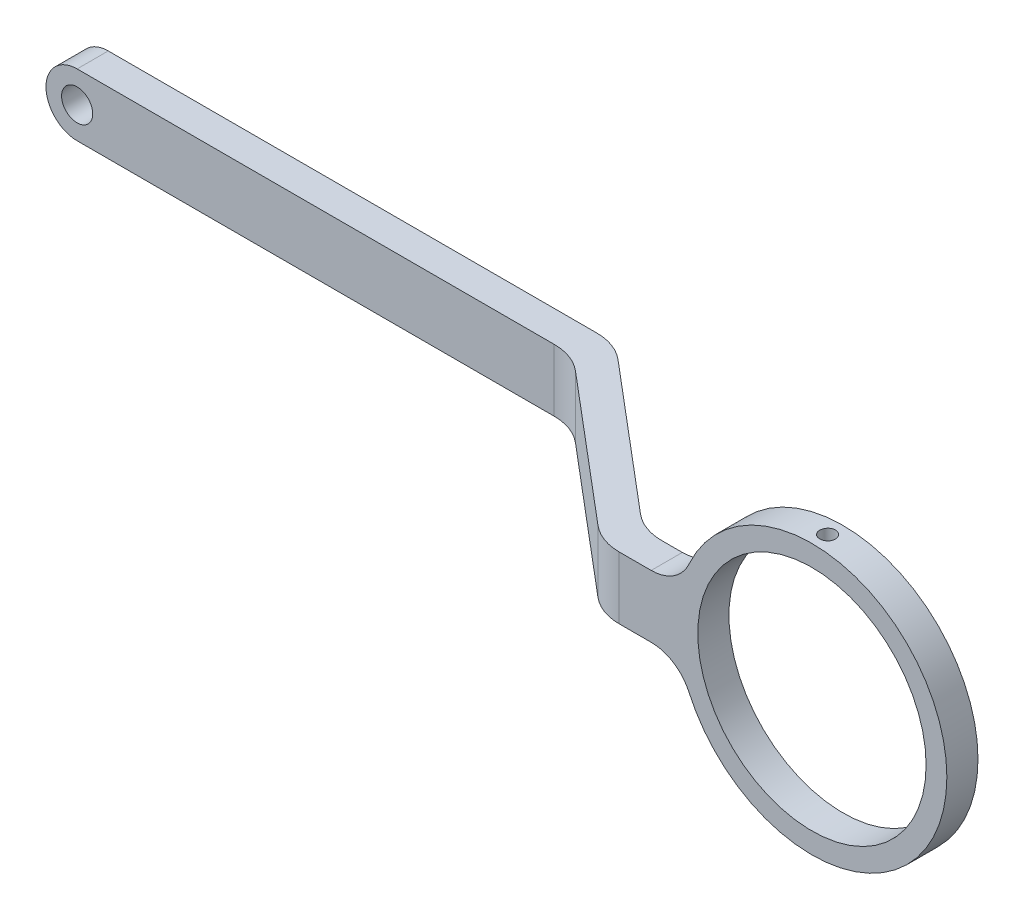
from build123d import *

# Parameters (mm, degrees)
BOSS_EXTRUDE1_DEPTH = 76.2
FILLET1_R           = 127
CUT_EXTRUDE1_DEPTH  = 152.4
SKETCH4_R           = 38.1
CUT_EXTRUDE2_DEPTH  = 152.4
SKETCH5_R           = 330.2
SKETCH5_R_2         = 279.4
BOSS_EXTRUDE2_DEPTH = 76.2
CUT_EXTRUDE3_DEPTH  = 76.2
SKETCH7_R           = 279.4
CUT_EXTRUDE4_DEPTH  = 76.2
FILLET2_R           = 101.6
SKETCH10_R          = 19.05
CUT_EXTRUDE5_DEPTH  = 1983.041579978


with BuildPart() as part:
    # Sketch1 → Boss-Extrude1 (new, symmetric)
    with BuildSketch(Plane(origin=(0, 0, 0), x_dir=(1, 0, 0), z_dir=(0, 1, 0))):
        Polygon((666.144379946, 38.507212604), (1092.864379946, -322.007837556), (1913.344533237, -322.007837556), (1913.344533237, -398.207837556), (1064.984533237, -398.207837556), (638.264533237, -37.692787396), (-652.055466763, -37.692787396), (-652.055466763, 38.507212604), align=None)
    extrude(amount=BOSS_EXTRUDE1_DEPTH, both=True)

    # Fillet1
    fillet1_edges = [part.edges().sort_by_distance(p)[0] for p in [
        (666.144379946, 0, -38.507212604),
        (1092.864379946, 0, 322.007837556),
        (1064.984533237, 0, 398.207837556),
        (638.264533237, 0, 37.692787396),
    ]]
    fillet(fillet1_edges, radius=FILLET1_R)

    # Sketch3 → Cut-Extrude1 (cut)
    with BuildSketch(Plane.XY.offset(37.692787396)):
        with BuildLine():
            ThreePointArc((-652.055466763, -4.31e-07), (-629.737003641, 53.881536574), (-575.855466763, 76.2))
            Line((-575.855466763, 76.2), (-652.055466763, 76.2))
            Line((-652.055466763, 76.2), (-652.055466763, -4.31e-07))
        make_face()
        with BuildLine():
            ThreePointArc((-575.855466763, -76.2), (-629.737003336, -53.881536879), (-652.055466763, -4.31e-07))
            Line((-652.055466763, -4.31e-07), (-652.055466763, -76.2))
            Line((-652.055466763, -76.2), (-575.855466763, -76.2))
        make_face()
    extrude(amount=-CUT_EXTRUDE1_DEPTH, mode=Mode.SUBTRACT)

    # Sketch4 → Cut-Extrude2 (cut)
    with BuildSketch(Plane.XY.offset(37.692787396)):
        with Locations((-575.855466763, 0)):
            Circle(SKETCH4_R)
    extrude(amount=-CUT_EXTRUDE2_DEPTH, mode=Mode.SUBTRACT)

    # Sketch5 → Boss-Extrude2 (add)
    with BuildSketch(Plane.XY.offset(398.207837556)):
        with Locations((1583.144533237, 0)):
            Circle(SKETCH5_R)
        with Locations((1583.144533237, 0)):
            Circle(SKETCH5_R_2, mode=Mode.SUBTRACT)
    extrude(amount=-BOSS_EXTRUDE2_DEPTH)

    # Sketch6 → Cut-Extrude3 (cut)
    with BuildSketch(Plane.XY.offset(398.207837556)):
        with BuildLine():
            Line((1913.344533237, 76.2), (1904.431943511, 76.2))
            ThreePointArc((1904.431943511, 76.2), (1911.108817019, 38.359725806), (1913.344533237, 0))
            Line((1913.344533237, 0), (1913.344533237, 76.2))
        make_face()
        with BuildLine():
            Line((1913.344533237, -76.2), (1913.344533237, 0))
            ThreePointArc((1913.344533237, 0), (1911.108817019, -38.359725806), (1904.431943511, -76.2))
            Line((1904.431943511, -76.2), (1913.344533237, -76.2))
        make_face()
    extrude(amount=-CUT_EXTRUDE3_DEPTH, mode=Mode.SUBTRACT)

    # Sketch7 → Cut-Extrude4 (cut)
    with BuildSketch(Plane.XY.offset(398.207837556)):
        with Locations((1583.144533237, 0)):
            Circle(SKETCH7_R)
    extrude(amount=-CUT_EXTRUDE4_DEPTH, mode=Mode.SUBTRACT)

    # Fillet2
    fillet2_edges = [part.edges().sort_by_distance(p)[0] for p in [
        (1261.857122964, -76.2, 360.107837556),
        (1261.857122964, 76.2, 360.107837556),
    ]]
    fillet(fillet2_edges, radius=FILLET2_R)

    # Sketch10 → Cut-Extrude5 (cut, through all)
    with BuildSketch(Plane(origin=(0, 0, 0), x_dir=(1, 0, 0), z_dir=(0, 1, 0))):
        with Locations(Location((1583.144533237, -360.107837556, 0), (0, 0, 90))):
            Circle(SKETCH10_R)
    extrude(amount=CUT_EXTRUDE5_DEPTH, mode=Mode.SUBTRACT)


solid = part.part
